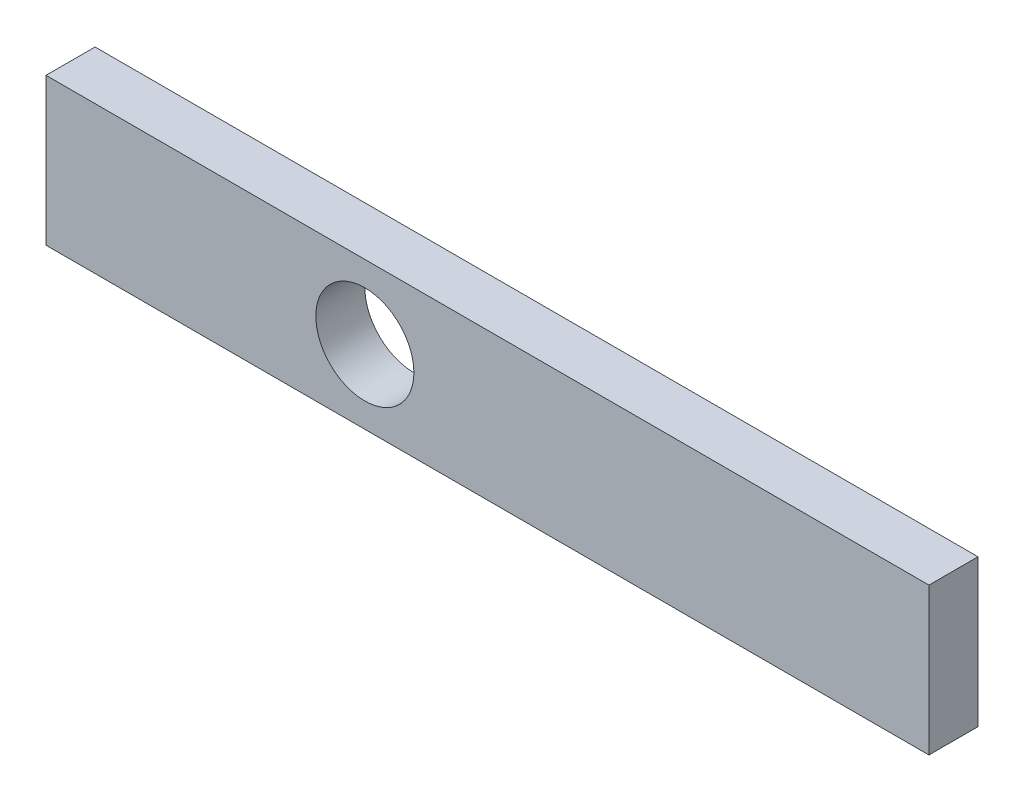
from build123d import *

# Parameters (mm, degrees)
ESQUISSE1_W        = 180
ESQUISSE1_H        = 30
ESQUISSE1_R        = 10
BOSS_EXTRU_1_DEPTH = 10


with BuildPart() as part:
    # Esquisse1 → Boss.-Extru.1 (new body)
    with BuildSketch(Plane.XY):
        Rectangle(ESQUISSE1_W, ESQUISSE1_H)
        with Locations((-25, 0)):
            Circle(ESQUISSE1_R, mode=Mode.SUBTRACT)
    extrude(amount=BOSS_EXTRU_1_DEPTH)


solid = part.part
